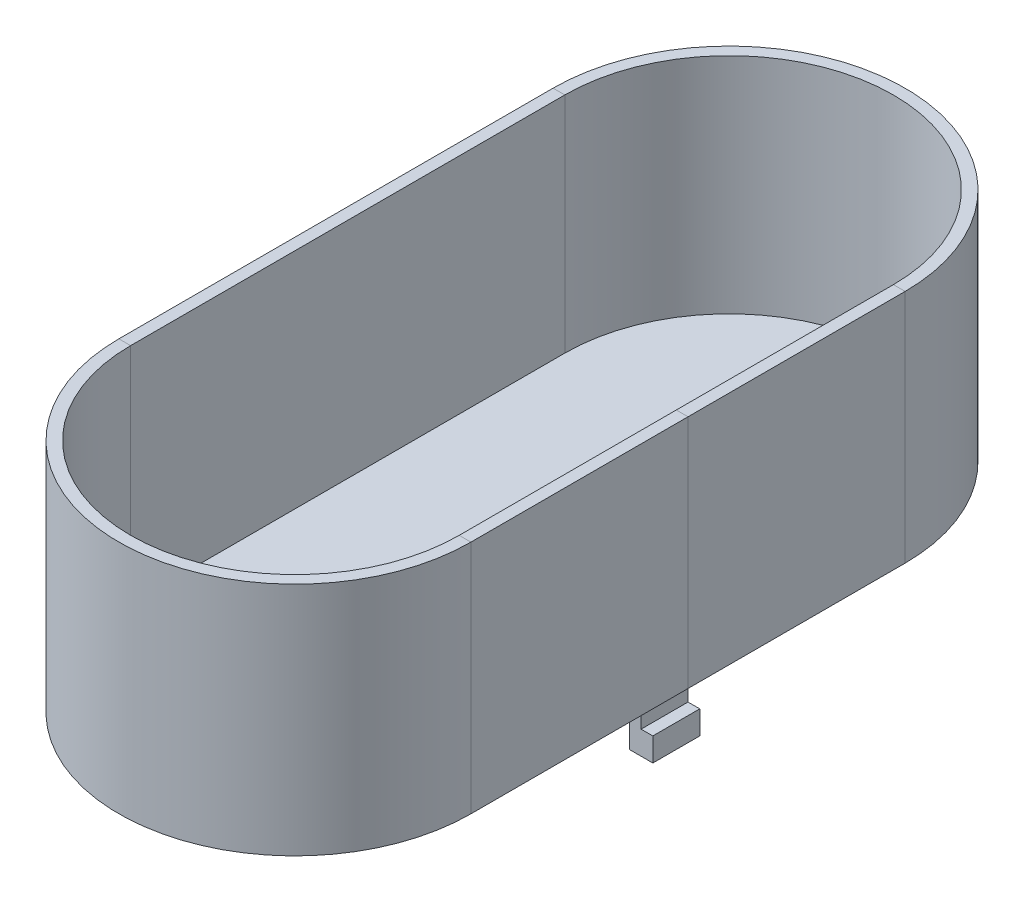
from build123d import *

# Parameters (mm, degrees)
SKETCH1_W           = 1
SKETCH1_H           = 20.053205005
BOSS_EXTRUDE2_DEPTH = 1
BOSS_EXTRUDE4_DEPTH = 2


with BuildPart() as part:
    # Sweep9: sweep along a path in Sketch2
    with BuildLine(Plane(origin=(0, 0, 0), x_dir=(1, 0, 0), z_dir=(0, 1, 0))) as sweep9_path:
        Line((15.5, -18.5), (15.5, 18.5))
        ThreePointArc((15.5, 18.5), (1.5, 32.5), (-12.5, 18.5))
        Line((-12.5, 18.5), (-12.5, -18.5))
        ThreePointArc((-12.5, -18.5), (1.5, -32.5), (15.5, -18.5))
    # Sketch1 → Sweep9 (sweep)
    with BuildSketch(Plane.XY):
        with Locations((16, 0.026602503)):
            Rectangle(SKETCH1_W, SKETCH1_H)
    sweep(path=sweep9_path.line)

    # Sketch6 → Boss-Extrude2 (add)
    with BuildSketch(Plane.XZ.offset(10)):
        with BuildLine():
            Line((15.5, 0), (15.5, -18.5))
            ThreePointArc((15.5, -18.5), (1.5, -32.5), (-12.5, -18.5))
            Line((-12.5, -18.5), (-12.5, 18.5))
            ThreePointArc((-12.5, 18.5), (1.5, 32.5), (15.5, 18.5))
            Line((15.5, 18.5), (15.5, 0))
        make_face()
    extrude(amount=-BOSS_EXTRUDE2_DEPTH)

    # Sketch8 → Boss-Extrude4 (add, symmetric)
    with BuildSketch(Plane.XY):
        Polygon((-12.5, -13), (-12.5, -15), (-10.5, -15), (-10.5, -10), (-11.5, -10), (-11.5, -13), align=None)
        Polygon((15.5, -13), (14.5, -13), (14.5, -10), (13.5, -10), (13.5, -15), (15.5, -15), align=None)
    extrude(amount=BOSS_EXTRUDE4_DEPTH, both=True)


solid = part.part
